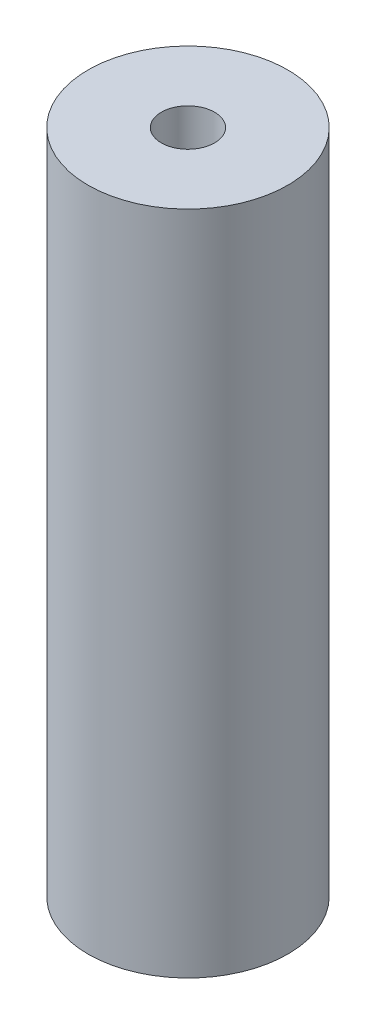
from build123d import *

# Parameters (mm, degrees)
SKETCH1_R           = 4.5
BOSS_EXTRUDE1_DEPTH = 30
SKETCH2_R           = 3.05
CUT_EXTRUDE1_DEPTH  = 31.66757245
SKETCH3_R           = 3.05
BOSS_EXTRUDE2_DEPTH = 10
SKETCH4_R           = 1.2
CUT_EXTRUDE2_DEPTH  = 10


with BuildPart() as part:
    # Sketch1 → Boss-Extrude1 (new body)
    with BuildSketch(Plane(origin=(0, 0, 0), x_dir=(1, 0, 0), z_dir=(0, 1, 0))):
        with Locations(Location((0, 0, 0), (0, 0, 270))):
            Circle(SKETCH1_R)
    extrude(amount=BOSS_EXTRUDE1_DEPTH)

    # Sketch2 → Cut-Extrude1 (cut, through all)
    with BuildSketch(Plane(origin=(0, 30, 0), x_dir=(1, 0, 0), z_dir=(0, 1, 0))):
        with Locations(Location((0, 0, 0), (0, 0, 270))):
            Circle(SKETCH2_R)
    extrude(amount=-CUT_EXTRUDE1_DEPTH, mode=Mode.SUBTRACT)

    # Sketch3 → Boss-Extrude2 (add)
    with BuildSketch(Plane(origin=(0, 30, 0), x_dir=(1, 0, 0), z_dir=(0, 1, 0))):
        with Locations(Location((0, 0, 0), (0, 0, 270))):
            Circle(SKETCH3_R)
    extrude(amount=-BOSS_EXTRUDE2_DEPTH)

    # Sketch4 → Cut-Extrude2 (cut)
    with BuildSketch(Plane(origin=(0, 30, 0), x_dir=(1, 0, 0), z_dir=(0, 1, 0))):
        with Locations(Location((0, 0, 0), (0, 0, 270))):
            Circle(SKETCH4_R)
    extrude(amount=-CUT_EXTRUDE2_DEPTH, mode=Mode.SUBTRACT)


solid = part.part
